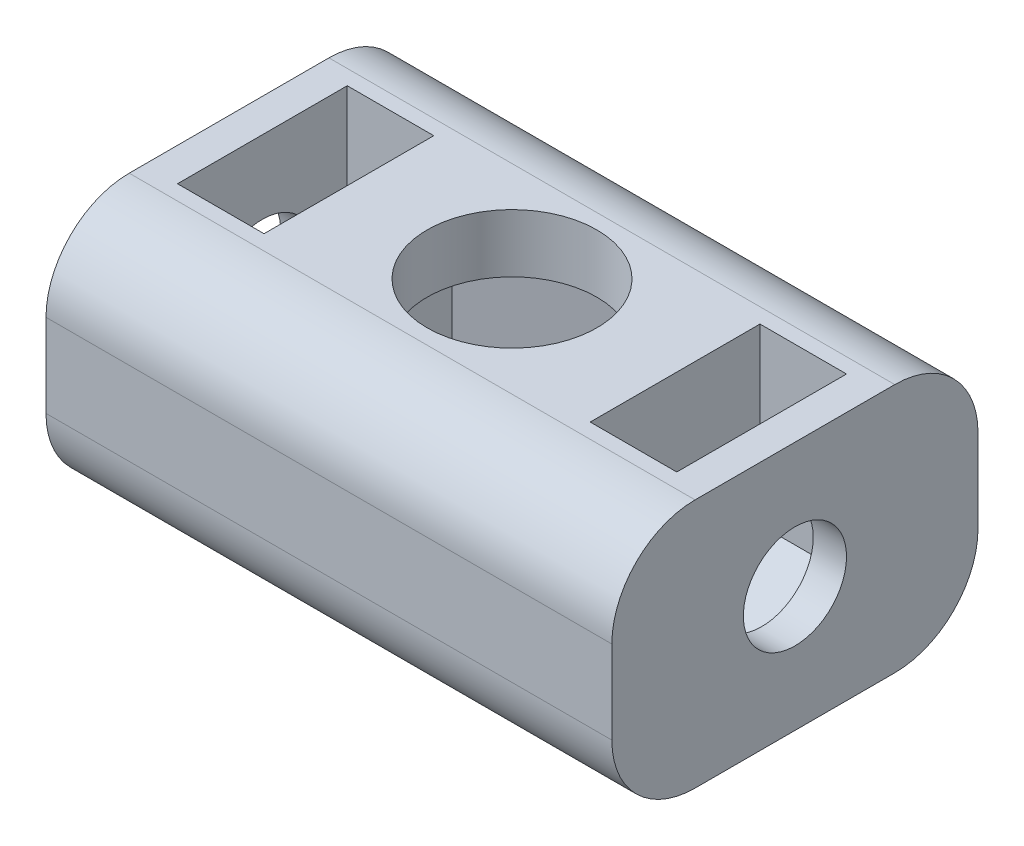
from build123d import *

# Parameters (mm, degrees)
CROQUIS1_W                 = 34
CROQUIS1_H                 = 22
CROQUIS1_R                 = 5.1
SALIENTE_EXTRUIR1_DEPTH    = 15
CORTAR_EXTRUIR1_DEPTH      = 5.2
CORTAR_EXTRUIR2_DEPTH      = 5.2
CORTAR_EXTRUIR3_DEPTH      = 4
CORTAR_EXTRUIR3_DEPTH_BACK = 4
CROQUIS5_R                 = 3.1
CORTAR_EXTRUIR4_DEPTH      = 4
CORTAR_EXTRUIR5_START      = -4
CROQUIS6_R                 = 3.1
CORTAR_EXTRUIR5_DEPTH      = 4
REDONDEO1_R                = 5


with BuildPart() as part:
    # Croquis1 → Saliente-Extruir1 (new body)
    with BuildSketch(Plane(origin=(0, 0, 0), x_dir=(1, 0, 0), z_dir=(0, 1, 0))):
        with Locations((17, 11)):
            Rectangle(CROQUIS1_W, CROQUIS1_H)
        with Locations(Location((17, 11, 0), (0, 0, 270))):
            Circle(CROQUIS1_R, mode=Mode.SUBTRACT)
    extrude(amount=SALIENTE_EXTRUIR1_DEPTH)

    # Croquis2 → Cortar-Extruir1 (cut)
    with BuildSketch(Plane.ZY.offset(-2)):
        Polygon((-16.1, 10.444486373), (-16.1, 15), (-5.9, 15), (-5.9, 10.444486373), (-5.9, 4.555513627), (-11, 1.611027254), (-16.1, 4.555513627), align=None)
    extrude(amount=-CORTAR_EXTRUIR1_DEPTH, mode=Mode.SUBTRACT)

    # Croquis3 → Cortar-Extruir2 (cut)
    with BuildSketch(Plane(origin=(32, 0, 0), x_dir=(0, 0, -1), z_dir=(1, 0, 0))):
        Polygon((5.9, 15), (5.9, 4.555513627), (11, 1.611027254), (16.1, 4.555513627), (16.1, 15), align=None)
    extrude(amount=-CORTAR_EXTRUIR2_DEPTH, mode=Mode.SUBTRACT)

    # Croquis4 → Cortar-Extruir3 (cut, two sides: drawn at the far end of the back side and taken through both)
    with BuildSketch(Plane(origin=(0, 7.5, 0), x_dir=(1, 0, 0), z_dir=(0, 1, 0)).offset(-CORTAR_EXTRUIR3_DEPTH_BACK)):
        Polygon((8.5, 6.092522712), (17, 1.185045424), (25.5, 6.092522712), (25.5, 15.907477288), (17, 20.814954576), (8.5, 15.907477288), align=None)
    extrude(amount=CORTAR_EXTRUIR3_DEPTH + CORTAR_EXTRUIR3_DEPTH_BACK, mode=Mode.SUBTRACT)

    # Croquis5 → Cortar-Extruir4 (cut)
    with BuildSketch(Plane(origin=(34, 0, 0), x_dir=(0, 0, -1), z_dir=(1, 0, 0))):
        with Locations((11, 7.5)):
            Circle(CROQUIS5_R)
    extrude(amount=-CORTAR_EXTRUIR4_DEPTH, mode=Mode.SUBTRACT)

    # Croquis6 → Cortar-Extruir5 (cut)
    with BuildSketch(Plane.ZY.offset(CORTAR_EXTRUIR5_START)):
        with Locations(Location((-11, 7.5, 0), (0, 0, 180))):
            Circle(CROQUIS6_R)
    extrude(amount=CORTAR_EXTRUIR5_DEPTH, mode=Mode.SUBTRACT)

    # Redondeo1
    redondeo1_edges = [part.edges().sort_by_distance(p)[0] for p in [
        (17, 15, -22),
        (17, 0, -22),
        (17, 0, 0),
        (17, 15, 0),
    ]]
    fillet(redondeo1_edges, radius=REDONDEO1_R)


solid = part.part
